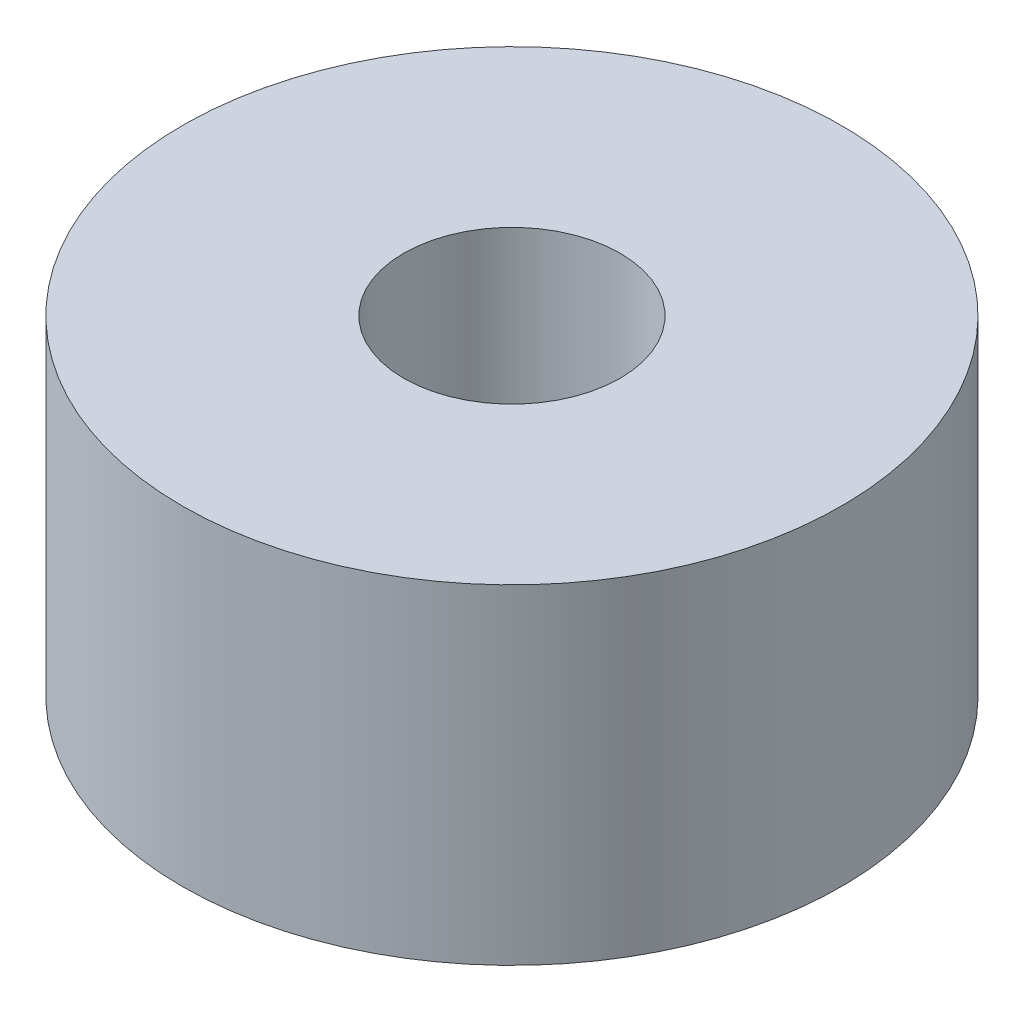
from build123d import *

# Parameters (mm, degrees)
SKETCH1_R           = 350
SKETCH1_R_2         = 115
BOSS_EXTRUDE1_DEPTH = 350


with BuildPart() as part:
    # Sketch1 → Boss-Extrude1 (new body)
    with BuildSketch(Plane(origin=(0, 0, 0), x_dir=(1, 0, 0), z_dir=(0, 1, 0))):
        Circle(SKETCH1_R)
        Circle(SKETCH1_R_2, mode=Mode.SUBTRACT)
    extrude(amount=-BOSS_EXTRUDE1_DEPTH)


solid = part.part
